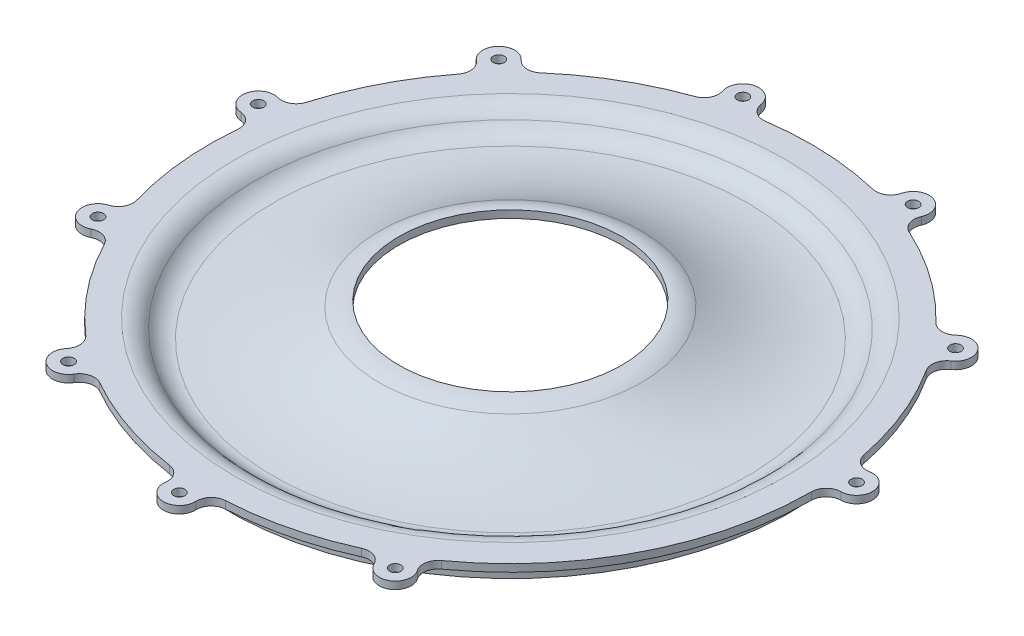
from build123d import *

# Parameters (mm, degrees)
SKETCH2_R           = 1.5
BOSS_EXTRUDE1_DEPTH = 2
CIRPATTERN1_COUNT   = 11


with BuildPart() as part:
    # Sketch1 → Revolve2 (revolve)
    with BuildSketch(Plane.XY, mode=Mode.PRIVATE) as revolve2_sk:
        with BuildLine():
            ThreePointArc((34.328340107, 16.866562419), (48.522419142, 11.000585737), (63.75, 9))
            Line((63.75, 9), (75, 9))
            Line((75, 9), (76, 9))
            Line((76, 9), (76, 14))
            Line((76, 14), (81, 14))
            Line((81, 14), (81, 16))
            Line((81, 16), (74, 16))
            ThreePointArc((74, 16), (71.148866911, 15.34166622), (68.875, 13.499957088))
            ThreePointArc((68.875, 13.499957088), (66.601133089, 11.658247956), (63.75, 10.999914176))
            ThreePointArc((63.75, 10.999914176), (49.038996589, 12.932632438), (35.32643469, 18.599612884))
            ThreePointArc((35.32643469, 18.599612884), (32.756692767, 19.655344367), (30, 20))
            Line((30, 20), (30, 18))
            ThreePointArc((30, 18), (32.240109584, 17.72327699), (34.328340107, 16.866562419))
        make_face()
    revolve(revolve2_sk.sketch.rotate(Axis((0, -11, 0), (0, 1, 0)), 90), axis=Axis((0, -11, 0), (0, 1, 0)))

    # Sketch2 → Boss-Extrude1 (add)
    with BuildSketch(Plane(origin=(0, 16, 0), x_dir=(1, 0, 0), z_dir=(0, 1, 0))):
        with BuildLine():
            ThreePointArc((69.296531703, 49.288508752), (67.592037892, 46.777022023), (68.141536159, 43.791906214))
            ThreePointArc((68.141536159, 43.791906214), (63.565042795, 50.204435407), (58.387245806, 56.142047765))
            ThreePointArc((58.387245806, 56.142047765), (61.16383943, 54.915918657), (64.001886983, 55.992185739))
            ThreePointArc((64.001886983, 55.992185739), (70.29195078, 55.51742825), (69.296531703, 49.288508752))
        make_face()
        with Locations(Location((66.928496787, 52.860931829, 0), (0, 0, 270))):
            Circle(SKETCH2_R, mode=Mode.SUBTRACT)
    boss_extrude1 = extrude(amount=-BOSS_EXTRUDE1_DEPTH)

    # CirPattern1: Boss-Extrude1 ×11 about axis, 1 skipped
    cirpattern1_axis = Axis((0, 0, 0), (0, -1, 0))
    add([boss_extrude1.rotate(cirpattern1_axis, i * 360 / CIRPATTERN1_COUNT) for i in range(1, CIRPATTERN1_COUNT) if i not in (2,)])


solid = part.part
